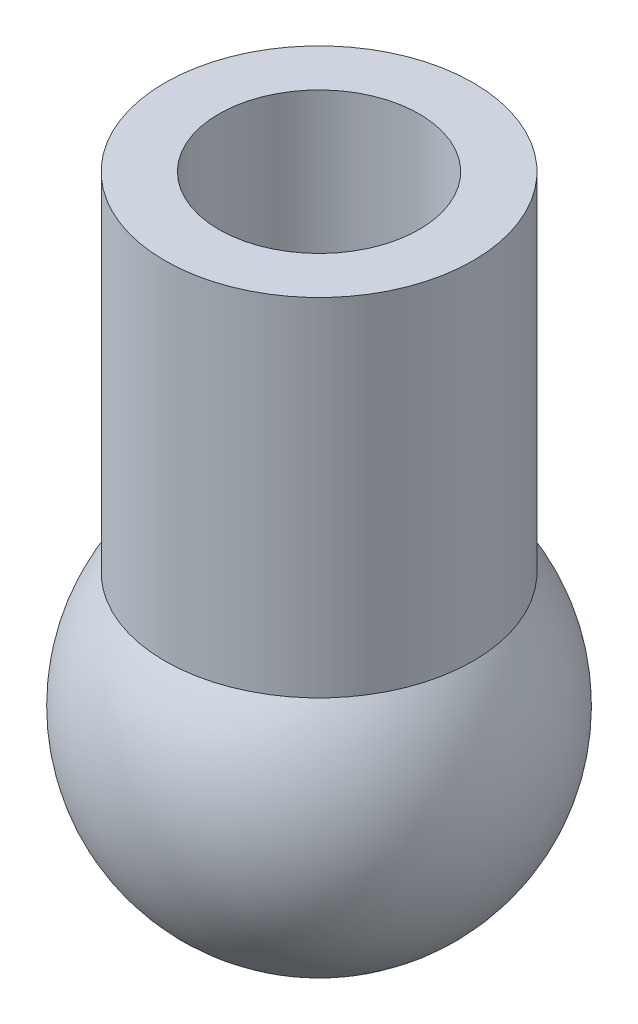
from build123d import *

# Parameters (mm, degrees)
SKETCH2_R           = 1.3
CUT_EXTRUDE1_DEPTH  = 15
BOSS_EXTRUDE1_START = 6
SKETCH3_R           = 2
SKETCH3_R_2         = 1.3
BOSS_EXTRUDE1_DEPTH = 6


with BuildPart() as part:
    # Sketch1 → Revolve2 (revolve)
    with BuildSketch(Plane.XY):
        with BuildLine():
            Line((-2.5, 0), (2.5, 0))
            ThreePointArc((2.5, 0), (0, -2.5), (-2.5, 0))
        make_face()
    revolve(axis=Axis((4.664316952, 0, 0), (-1, 0, 0)))

    # Sketch2 → Cut-Extrude1 (cut, symmetric)
    with BuildSketch(Plane(origin=(0, 0, 0), x_dir=(1, 0, 0), z_dir=(0, 1, 0))):
        with Locations(Location((0, 0, 0), (0, 0, 90))):
            Circle(SKETCH2_R)
    extrude(amount=CUT_EXTRUDE1_DEPTH, both=True, mode=Mode.SUBTRACT)

    # Sketch3 → Boss-Extrude1 (add)
    with BuildSketch(Plane(origin=(0, 0, 0), x_dir=(1, 0, 0), z_dir=(0, 1, 0)).offset(BOSS_EXTRUDE1_START)):
        with Locations(Location((0, 0, 0), (0, 0, 270))):
            Circle(SKETCH3_R)
        with Locations(Location((0, 0, 0), (0, 0, 270))):
            Circle(SKETCH3_R_2, mode=Mode.SUBTRACT)
    extrude(amount=-BOSS_EXTRUDE1_DEPTH)


solid = part.part
